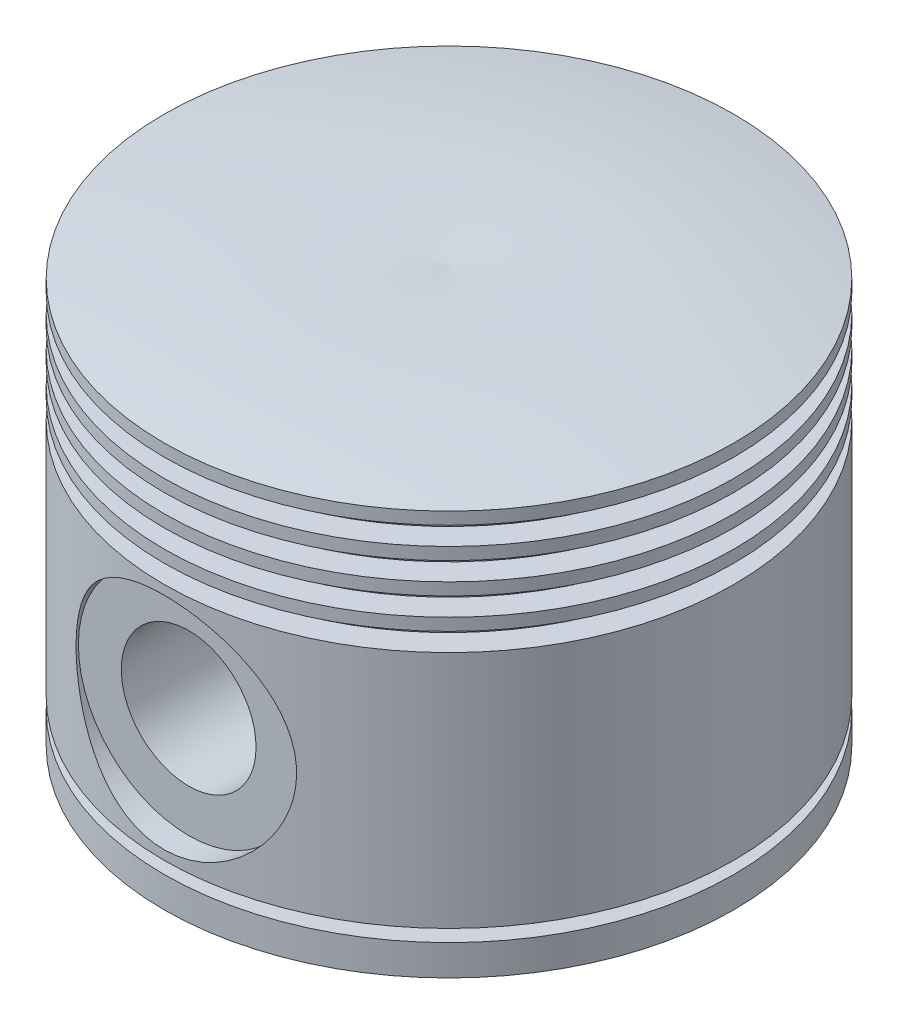
from build123d import *

# Parameters (mm, degrees)
SKETCH3_R               = 37
CUT_EXTRUDE2_DEPTH      = 62
CUT_EXTRUDE3_START      = 42.5
SKETCH5_R               = 18
CUT_EXTRUDE3_DEPTH      = 10
BOSS_EXTRUDE1_START     = 25
SKETCH5_5_R             = 18
BOSS_EXTRUDE1_DEPTH     = 15
CUT_EXTRUDE4_DEPTH      = 86.76414545
CUT_EXTRUDE4_DEPTH_BACK = 86.76414545
SKETCH5_6_R             = 11


with BuildPart() as part:
    # Sketch1 → Revolve1 (revolve)
    with BuildSketch(Plane(origin=(0, 0, 0), x_dir=(0, 0, -1), z_dir=(1, 0, 0))):
        with BuildLine():
            ThreePointArc((0, 54.442990874), (-23.311799933, 54.879839317), (-46.5, 52.442990874))
            Line((-46.5, 52.442990874), (-46.5, 50.442990874))
            Line((-46.5, 50.442990874), (-42.5, 50.442990874))
            Line((-42.5, 50.442990874), (-42.5, 47.442990874))
            Line((-42.5, 47.442990874), (-46.5, 47.442990874))
            Line((-46.5, 47.442990874), (-46.5, 45.442990874))
            Line((-46.5, 45.442990874), (-42.5, 45.442990874))
            Line((-42.5, 45.442990874), (-42.5, 42.442990874))
            Line((-42.5, 42.442990874), (-46.5, 42.442990874))
            Line((-46.5, 42.442990874), (-46.5, 40.442990874))
            Line((-46.5, 40.442990874), (-42.5, 40.442990874))
            Line((-42.5, 40.442990874), (-42.5, 37.442990874))
            Line((-42.5, 37.442990874), (-46.5, 37.442990874))
            Line((-46.5, 37.442990874), (-46.5, 35.442990874))
            Line((-46.5, 35.442990874), (-42.5, 35.442990874))
            Line((-42.5, 35.442990874), (-42.5, 32.442990874))
            Line((-42.5, 32.442990874), (-46.5, 32.442990874))
            Line((-46.5, 32.442990874), (-46.5, -6.557009126))
            Line((-46.5, -6.557009126), (-42.5, -6.557009126))
            Line((-42.5, -6.557009126), (-42.5, -8.557009126))
            Line((-42.5, -8.557009126), (-46.5, -8.557009126))
            Line((-46.5, -8.557009126), (-46.5, -13.557009126))
            Line((-46.5, -13.557009126), (0, -13.557009126))
            Line((0, -13.557009126), (0, 54.442990874))
        make_face()
    revolve(axis=Axis((0, 54.442990874, 0), (0, -1, 0)))

    # Sketch3 → Cut-Extrude2 (cut)
    with BuildSketch(Plane.XZ.offset(13.557009126)):
        Circle(SKETCH3_R)
    extrude(amount=-CUT_EXTRUDE2_DEPTH, mode=Mode.SUBTRACT)

    # Sketch5 → Cut-Extrude3 (cut)
    with BuildSketch(Plane.XY.offset(CUT_EXTRUDE3_START)):
        with Locations((0, 12.942990874)):
            Circle(SKETCH5_R)
    cut_extrude3 = extrude(amount=CUT_EXTRUDE3_DEPTH, mode=Mode.SUBTRACT)

    # Mirror1: Cut-Extrude3 across plane
    add(cut_extrude3.mirror(Plane.XY), mode=Mode.SUBTRACT)

    # Sketch5<5> → Boss-Extrude1 (add)
    with BuildSketch(Plane.XY.offset(BOSS_EXTRUDE1_START)):
        with Locations((0, 12.942990874)):
            Circle(SKETCH5_5_R)
    boss_extrude1 = extrude(amount=BOSS_EXTRUDE1_DEPTH)

    # Mirror2: Boss-Extrude1 across plane
    add(boss_extrude1.mirror(Plane.XY))

    # Sketch5<6> → Cut-Extrude4 (cut, two sides: drawn at the far end of the back side and taken through both)
    with BuildSketch(Plane.XY.offset(-CUT_EXTRUDE4_DEPTH_BACK)):
        with Locations((0, 12.942990874)):
            Circle(SKETCH5_6_R)
    extrude(amount=CUT_EXTRUDE4_DEPTH + CUT_EXTRUDE4_DEPTH_BACK, mode=Mode.SUBTRACT)


solid = part.part
